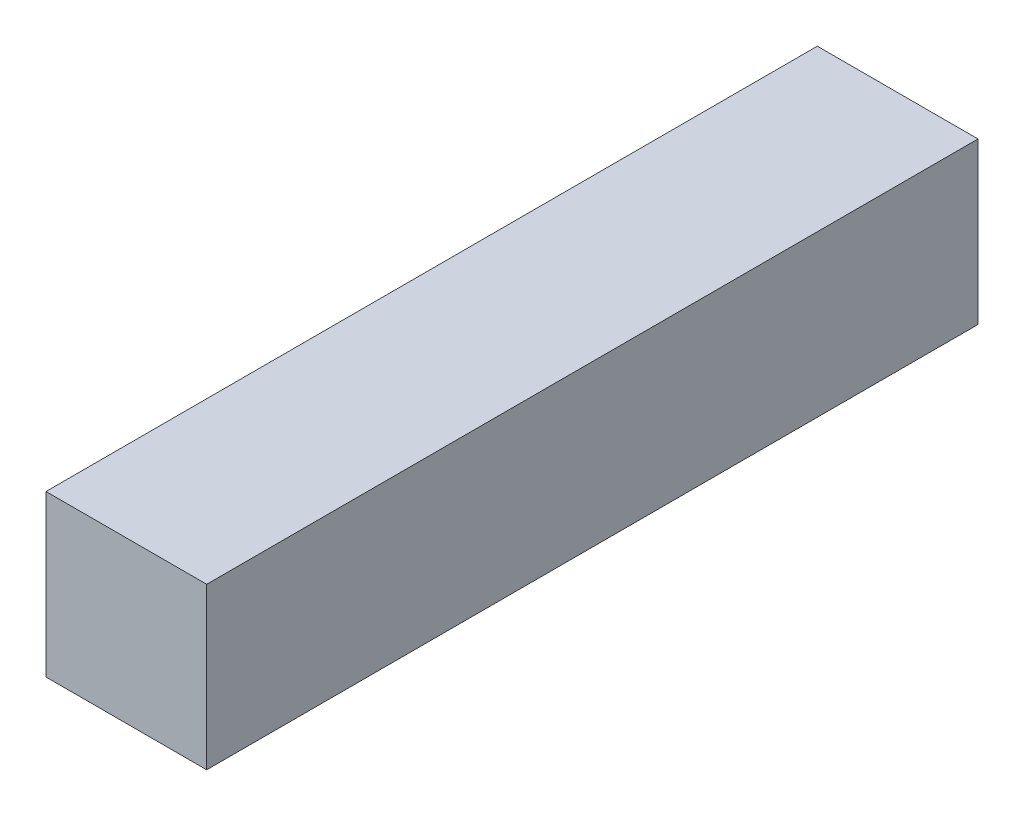
from build123d import *

# Parameters (mm, degrees)
SKETCH1_W           = 72
SKETCH1_H           = 15
BOSS_EXTRUDE1_DEPTH = 15


with BuildPart() as part:
    # Sketch1 → Boss-Extrude1 (new body)
    with BuildSketch(Plane(origin=(7.5, 0, 0), x_dir=(0, 0, -1), z_dir=(1, 0, 0))):
        with Locations((-36, 0)):
            Rectangle(SKETCH1_W, SKETCH1_H)
    extrude(amount=-BOSS_EXTRUDE1_DEPTH)


solid = part.part
